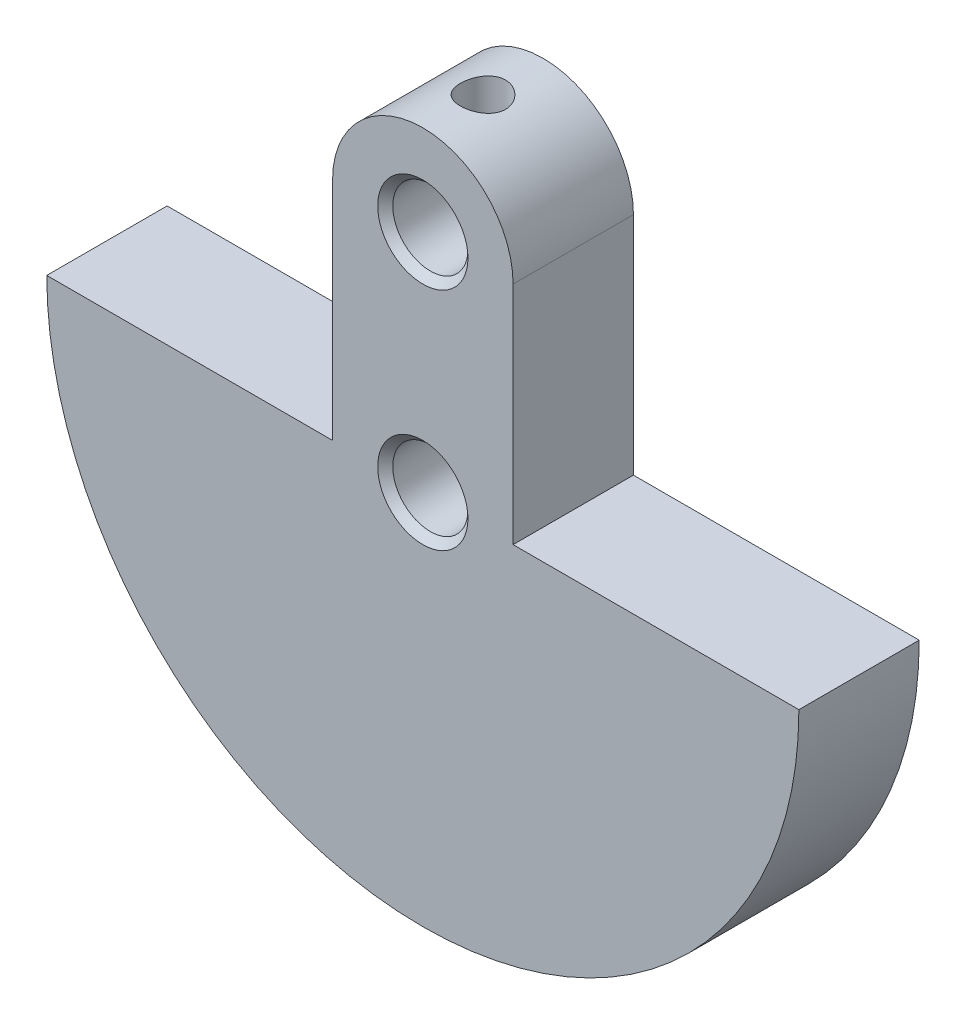
from build123d import *

# Parameters (mm, degrees)
SKETCH1_R           = 2.5
BOSS_EXTRUDE1_DEPTH = 8
CHAMFER1_SIZE       = 0.5
SKETCH2_R           = 1.5
CUT_EXTRUDE1_DEPTH  = 5


with BuildPart() as part:
    # Sketch1 → Boss-Extrude1 (new body)
    with BuildSketch(Plane.XY):
        with BuildLine():
            Line((-6, 15), (-6, 0))
            Line((-6, 0), (-25, 0))
            ThreePointArc((-25, 0), (0, -25), (25, 0))
            Line((25, 0), (6, 0))
            Line((6, 0), (6, 15))
            ThreePointArc((6, 15), (0, 21), (-6, 15))
        make_face()
        with Locations((0, 15)):
            Circle(SKETCH1_R, mode=Mode.SUBTRACT)
        Circle(SKETCH1_R, mode=Mode.SUBTRACT)
    extrude(amount=BOSS_EXTRUDE1_DEPTH)

    # Chamfer1
    chamfer1_edges = [part.edges().sort_by_distance(p)[0] for p in [
        (-2.5, 15, 8),
        (-2.5, 0, 8),
    ]]
    chamfer(chamfer1_edges, length=CHAMFER1_SIZE)

    # Sketch2 → Cut-Extrude1 (cut)
    with BuildSketch(Plane(origin=(0, 21, 0), x_dir=(1, 0, 0), z_dir=(0, 1, 0))):
        with Locations(Location((0, -4, 0), (0, 0, 270))):
            Circle(SKETCH2_R)
    extrude(amount=-CUT_EXTRUDE1_DEPTH, mode=Mode.SUBTRACT)


solid = part.part
